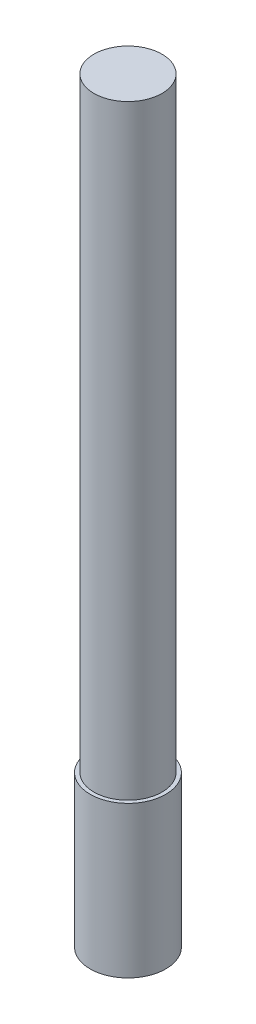
from build123d import *

# Parameters (mm, degrees)
SKETCH1_R           = 2.5
BOSS_EXTRUDE1_DEPTH = 5
SKETCH2_R           = 2.25
BOSS_EXTRUDE2_DEPTH = 40


with BuildPart() as part:
    # Sketch1 → Boss-Extrude1 (new, symmetric)
    with BuildSketch(Plane(origin=(0, 0, 0), x_dir=(1, 0, 0), z_dir=(0, 1, 0))):
        with Locations(Location((0, 0, 0), (0, 0, 270))):
            Circle(SKETCH1_R)
    extrude(amount=BOSS_EXTRUDE1_DEPTH, both=True)

    # Sketch2 → Boss-Extrude2 (add)
    with BuildSketch(Plane(origin=(0, 5, 0), x_dir=(1, 0, 0), z_dir=(0, 1, 0))):
        with Locations(Location((0, 0, 0), (0, 0, 270))):
            Circle(SKETCH2_R)
    extrude(amount=BOSS_EXTRUDE2_DEPTH)


solid = part.part
